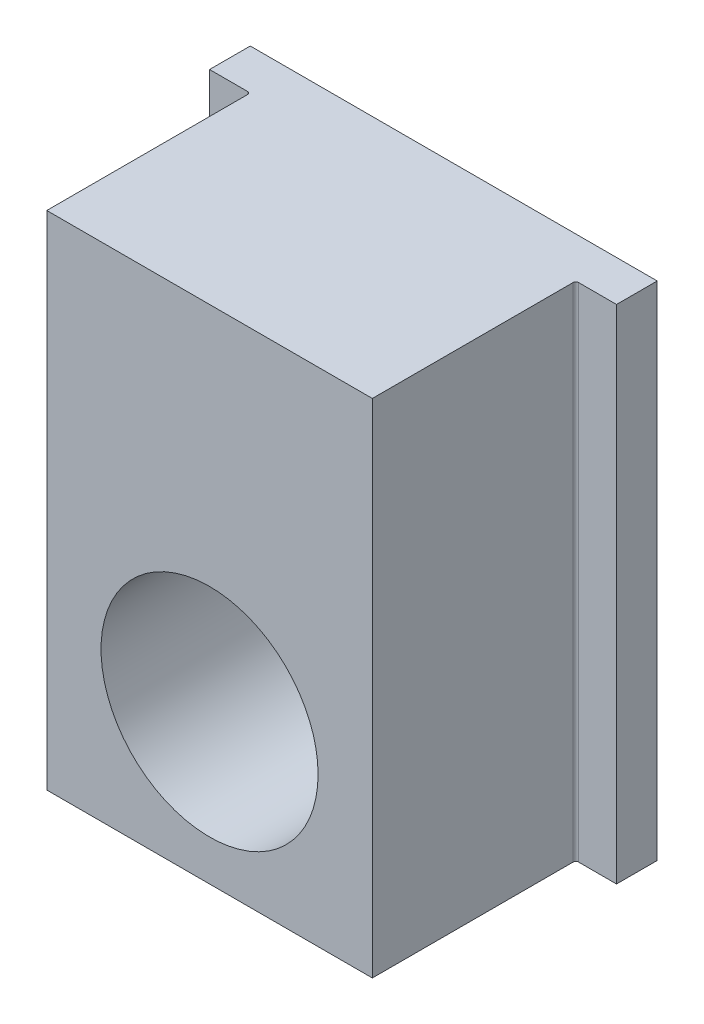
from build123d import *

# Parameters (mm, degrees)
ESTRUSIONE_ESTRUSIONE1_DEPTH = 37
SCHIZZO4_R                   = 8
TAGLIO_ESTRUSIONE1_DEPTH     = 44.794976881
RACCORDO1_R                  = 0.2


with BuildPart() as part:
    # Schizzo1 → Estrusione-Estrusione1 (new body)
    with BuildSketch(Plane(origin=(0, 0, 0), x_dir=(1, 0, 0), z_dir=(0, 1, 0))):
        Polygon((-15, 0), (15, 0), (15, -3), (12, -3), (12, -18), (-12, -18), (-12, -3), (-15, -3), align=None)
    extrude(amount=ESTRUSIONE_ESTRUSIONE1_DEPTH)

    # Schizzo4 → Taglio-Estrusione1 (cut, through all)
    with BuildSketch(Plane.XY.offset(18)):
        with Locations((0, 11)):
            Circle(SCHIZZO4_R)
    extrude(amount=-TAGLIO_ESTRUSIONE1_DEPTH, mode=Mode.SUBTRACT)

    # Raccordo1
    raccordo1_edges = [part.edges().sort_by_distance(p)[0] for p in [
        (12, 18.5, 3),
        (-12, 18.5, 3),
    ]]
    fillet(raccordo1_edges, radius=RACCORDO1_R)


solid = part.part
